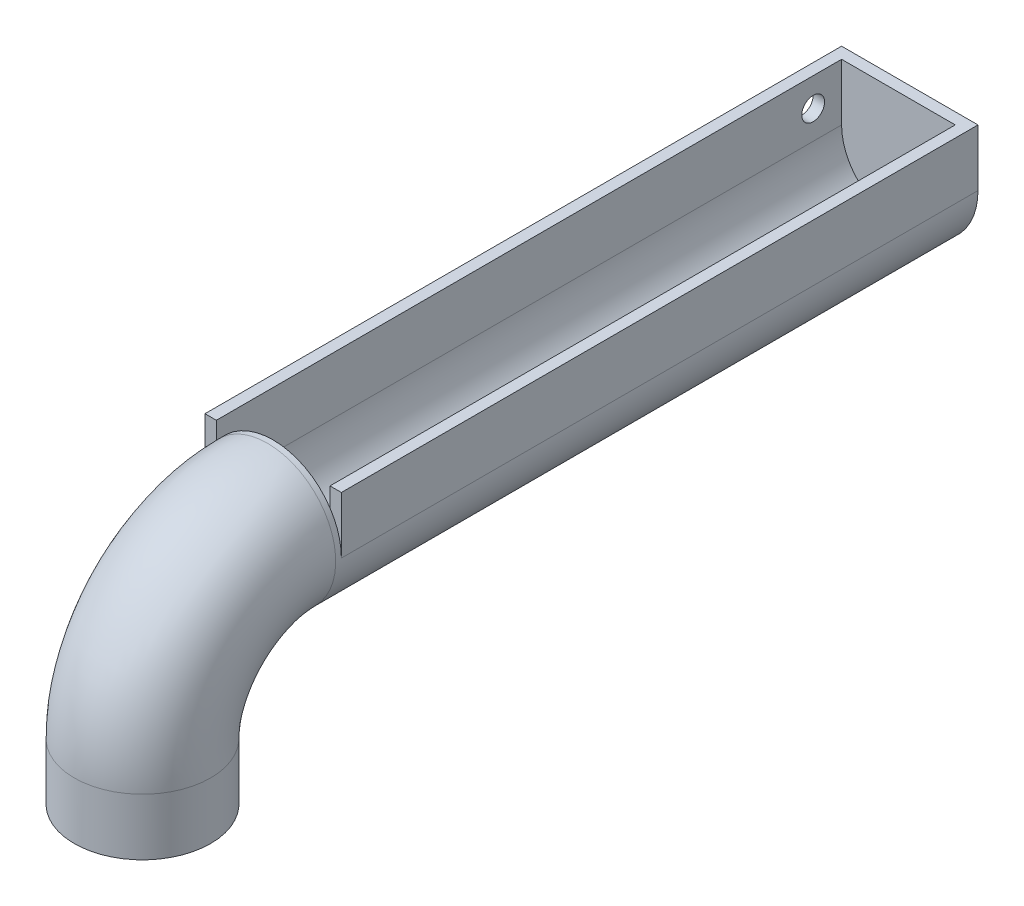
from build123d import *
from build123d.topology import SkipClean

# Parameters (mm, degrees)
BOSS_EXTRUDE1_DEPTH = 110
BOSS_EXTRUDE3_START = -112
BOSS_EXTRUDE3_DEPTH = 2
SKETCH15_R          = 2.005
CUT_EXTRUDE1_DEPTH  = 2
SKETCH18_R          = 12
SKETCH18_R_2        = 10


with BuildPart() as part:
    # Sketch1 → Boss-Extrude1 (new body)
    with BuildSketch(Plane.XY):
        with BuildLine():
            Line((-10, 0), (-10, 10))
            Line((-10, 10), (-12, 10))
            Line((-12, 10), (-12, 0))
            ThreePointArc((-12, 0), (0, -12), (12, 0))
            Line((12, 0), (12, 10))
            Line((12, 10), (10, 10))
            Line((10, 10), (10, 0))
            ThreePointArc((10, 0), (0, -10), (-10, 0))
        make_face()
    extrude(amount=BOSS_EXTRUDE1_DEPTH)

    # Sketch8 → Boss-Extrude3 (add)
    with BuildSketch(Plane.XY.offset(110).offset(BOSS_EXTRUDE3_START)):
        with BuildLine():
            Line((-12, 10), (12, 10))
            Line((12, 10), (12, 0))
            ThreePointArc((12, 0), (0, -12), (-12, 0))
            Line((-12, 0), (-12, 10))
        make_face()
    extrude(amount=BOSS_EXTRUDE3_DEPTH)

    # Sketch15 → Cut-Extrude1 (cut)
    with BuildSketch(Plane.ZY.offset(12)):
        with Locations((5, 5)):
            Circle(SKETCH15_R)
    extrude(amount=-CUT_EXTRUDE1_DEPTH, mode=Mode.SUBTRACT)

    # Sweep2: sweep along a path in Sketch17
    with SkipClean():  # the faces are left unmerged after this step: merging them gives an invalid solid
        with BuildLine(Plane(origin=(0, 0, 0), x_dir=(0, 0, -1), z_dir=(1, 0, 0))) as sweep2_path:
            Line((-110, -12), (-111, -12))
            ThreePointArc((-111, -12), (-118.071067812, -14.928932188), (-121, -22))
            Line((-121, -22), (-121, -32))
        # Sketch18 → Sweep2 (sweep)
        with BuildSketch(Plane.XY.offset(110)):
            Circle(SKETCH18_R)
            Circle(SKETCH18_R_2, mode=Mode.SUBTRACT)
        sweep(path=sweep2_path.line)


solid = part.part
